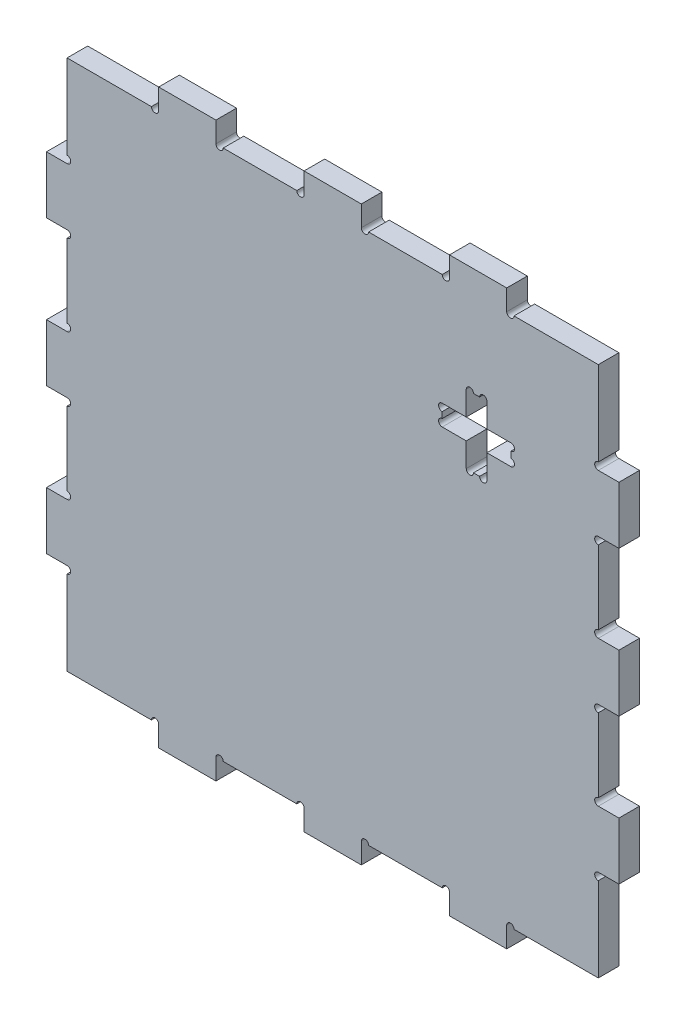
from build123d import *

# Parameters (mm, degrees)
ESTRUSIONE_ESTRUSIONE1_DEPTH = 18


with BuildPart() as part:
    # Schizzo1 → Estrusione-Estrusione1 (new body)
    with BuildSketch(Plane.XY):
        with BuildLine():
            Line((-152, 250), (-152, 232))
            ThreePointArc((-152, 232), (-155.175, 228.825), (-158.35, 232))
            Line((-158.35, 232), (-232, 232))
            Line((-232, 232), (-232, 158.35))
            ThreePointArc((-232, 158.35), (-228.825, 155.175), (-232, 152))
            Line((-232, 152), (-250, 152))
            Line((-250, 152), (-250, 102))
            Line((-250, 102), (-232, 102))
            ThreePointArc((-232, 102), (-228.825, 98.825), (-232, 95.65))
            Line((-232, 95.65), (-232, 31.35))
            ThreePointArc((-232, 31.35), (-228.825, 28.175), (-232, 25))
            Line((-232, 25), (-250, 25))
            Line((-250, 25), (-250, -25))
            Line((-250, -25), (-232, -25))
            ThreePointArc((-232, -25), (-228.825, -28.175), (-232, -31.35))
            Line((-232, -31.35), (-232, -95.65))
            ThreePointArc((-232, -95.65), (-228.825, -98.825), (-232, -102))
            Line((-232, -102), (-250, -102))
            Line((-250, -102), (-250, -152))
            Line((-250, -152), (-232, -152))
            ThreePointArc((-232, -152), (-228.825, -155.175), (-232, -158.35))
            Line((-232, -158.35), (-232, -232))
            Line((-232, -232), (-158.35, -232))
            ThreePointArc((-158.35, -232), (-155.175, -228.825), (-152, -232))
            Line((-152, -232), (-152, -250))
            Line((-152, -250), (-102, -250))
            Line((-102, -250), (-102, -232))
            ThreePointArc((-102, -232), (-98.825, -228.825), (-95.65, -232))
            Line((-95.65, -232), (-31.35, -232))
            ThreePointArc((-31.35, -232), (-28.175, -228.825), (-25, -232))
            Line((-25, -232), (-25, -250))
            Line((-25, -250), (25, -250))
            Line((25, -250), (25, -232))
            ThreePointArc((25, -232), (28.175, -228.825), (31.35, -232))
            Line((31.35, -232), (95.65, -232))
            ThreePointArc((95.65, -232), (98.825, -228.825), (102, -232))
            Line((102, -232), (102, -250))
            Line((102, -250), (152, -250))
            Line((152, -250), (152, -232))
            ThreePointArc((152, -232), (155.175, -228.825), (158.35, -232))
            Line((158.35, -232), (232, -232))
            Line((232, -232), (232, -158.35))
            ThreePointArc((232, -158.35), (228.825, -155.175), (232, -152))
            Line((232, -152), (250, -152))
            Line((250, -152), (250, -102))
            Line((250, -102), (232, -102))
            ThreePointArc((232, -102), (228.825, -98.825), (232, -95.65))
            Line((232, -95.65), (232, -31.35))
            ThreePointArc((232, -31.35), (228.825, -28.175), (232, -25))
            Line((232, -25), (250, -25))
            Line((250, -25), (250, 25))
            Line((250, 25), (232, 25))
            ThreePointArc((232, 25), (228.825, 28.175), (232, 31.35))
            Line((232, 31.35), (232, 95.65))
            ThreePointArc((232, 95.65), (228.825, 98.825), (232, 102))
            Line((232, 102), (250, 102))
            Line((250, 102), (250, 152))
            Line((250, 152), (232, 152))
            ThreePointArc((232, 152), (228.825, 155.175), (232, 158.35))
            Line((232, 158.35), (232, 232))
            Line((232, 232), (158.35, 232))
            ThreePointArc((158.35, 232), (155.175, 228.825), (152, 232))
            Line((152, 232), (152, 250))
            Line((152, 250), (102, 250))
            Line((102, 250), (102, 232))
            ThreePointArc((102, 232), (98.825, 228.825), (95.65, 232))
            Line((95.65, 232), (31.35, 232))
            ThreePointArc((31.35, 232), (28.175, 228.825), (25, 232))
            Line((25, 232), (25, 250))
            Line((25, 250), (-25, 250))
            Line((-25, 250), (-25, 232))
            ThreePointArc((-25, 232), (-28.175, 228.825), (-31.35, 232))
            Line((-31.35, 232), (-95.65, 232))
            ThreePointArc((-95.65, 232), (-98.825, 228.825), (-102, 232))
            Line((-102, 232), (-102, 250))
            Line((-102, 250), (-152, 250))
        make_face()
        with BuildLine():
            Line((134.65, 95.646711769), (134.65, 116.646711769))
            Line((134.65, 116.646711769), (155.65, 116.646711769))
            ThreePointArc((155.65, 116.646711769), (158.825, 119.821711769), (155.65, 122.996711769))
            Line((155.65, 122.996711769), (155.65, 128.296711769))
            ThreePointArc((155.65, 128.296711769), (158.825, 131.471711769), (155.65, 134.646711769))
            Line((155.65, 134.646711769), (134.65, 134.646711769))
            Line((134.65, 134.646711769), (134.65, 155.646711769))
            ThreePointArc((134.65, 155.646711769), (131.475, 158.821711769), (128.3, 155.646711769))
            Line((128.3, 155.646711769), (123, 155.646711769))
            ThreePointArc((123, 155.646711769), (119.825, 158.821711769), (116.65, 155.646711769))
            Line((116.65, 155.646711769), (116.65, 134.646711769))
            Line((116.65, 134.646711769), (95.65, 134.646711769))
            ThreePointArc((95.65, 134.646711769), (92.475, 131.471711769), (95.65, 128.296711769))
            Line((95.65, 128.296711769), (95.65, 122.996711769))
            ThreePointArc((95.65, 122.996711769), (92.475, 119.821711769), (95.65, 116.646711769))
            Line((95.65, 116.646711769), (116.65, 116.646711769))
            Line((116.65, 116.646711769), (116.65, 95.646711769))
            ThreePointArc((116.65, 95.646711769), (119.825, 92.471711769), (123, 95.646711769))
            Line((123, 95.646711769), (128.3, 95.646711769))
            ThreePointArc((128.3, 95.646711769), (131.475, 92.471711769), (134.65, 95.646711769))
        make_face(mode=Mode.SUBTRACT)
    extrude(amount=ESTRUSIONE_ESTRUSIONE1_DEPTH)


solid = part.part
